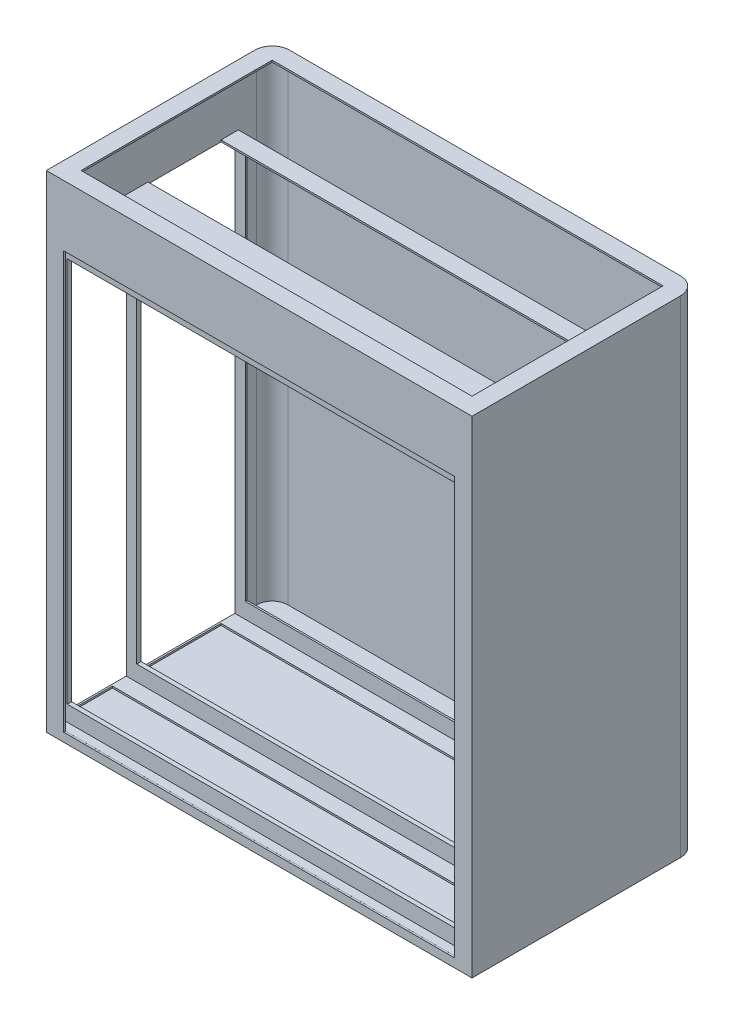
from build123d import *

# Parameters (mm, degrees)
BOSS_EXTRUDE1_DEPTH = 711.2
BOSS_EXTRUDE2_REACH = 963.601
SKETCH2_W           = 12.7
SKETCH2_H           = 2.54
SKETCH3_W           = 152.4
SKETCH3_H           = 609.6
SKETCH3_W_2         = 95.25
SKETCH3_W_3         = 12.7
CUT_EXTRUDE1_DEPTH  = 2.54
SKETCH4_W           = 12.7
SKETCH4_H           = 6.35
SKETCH4_H_2         = 2.54
BOSS_EXTRUDE3_DEPTH = 589.28
SKETCH5_W           = 571.5
SKETCH5_H           = 12.668198963
BOSS_EXTRUDE4_DEPTH = 2.54
BOSS_EXTRUDE5_START = -2.54
BOSS_EXTRUDE5_DEPTH = 2.54
SKETCH7_W           = 571.5
SKETCH7_H           = 19.05
BOSS_EXTRUDE6_DEPTH = 2.54
SKETCH9_W           = 571.5
SKETCH9_H           = 2.54
BOSS_EXTRUDE7_DEPTH = 69.85
SKETCH10_W          = 571.5
SKETCH10_H          = 22.86
BOSS_EXTRUDE8_DEPTH = 2.54
BOSS_EXTRUDE9_START = 10.16
BOSS_EXTRUDE9_DEPTH = 10.16


with BuildPart() as part:
    # Sketch1 → Boss-Extrude1 (new body)
    with BuildSketch(Plane(origin=(0, 0, 0), x_dir=(1, 0, 0), z_dir=(0, 1, 0))):
        with BuildLine():
            Line((-285.75, 175.26), (285.75, 175.26))
            ThreePointArc((285.75, 175.26), (301.914461018, 168.564461018), (308.61, 152.4))
            Line((308.61, 152.4), (308.61, -149.86))
            Line((308.61, -149.86), (285.75, -149.86))
            Line((285.75, -149.86), (285.75, -152.4))
            Line((285.75, -152.4), (311.15, -152.4))
            Line((311.15, -152.4), (311.15, 152.4))
            ThreePointArc((311.15, 152.4), (303.710512242, 170.360512242), (285.75, 177.8))
            Line((285.75, 177.8), (-285.75, 177.8))
            ThreePointArc((-285.75, 177.8), (-303.710512242, 170.360512242), (-311.15, 152.4))
            Line((-311.15, 152.4), (-311.15, -152.4))
            Line((-311.15, -152.4), (-285.75, -152.4))
            Line((-285.75, -152.4), (-285.75, -149.86))
            Line((-285.75, -149.86), (-308.61, -149.86))
            Line((-308.61, -149.86), (-308.61, 152.4))
            ThreePointArc((-308.61, 152.4), (-301.914461018, 168.564461018), (-285.75, 175.26))
        make_face()
    extrude(amount=BOSS_EXTRUDE1_DEPTH)

    # Boss-Extrude2: up to this face of the body (flat: up to its plane)
    boss_extrude2_end = Plane(part.part.faces().sort_by_distance((308.61, 355.6, -1.27))[0])
    # Sketch2 → Boss-Extrude2 (add, up to the picked face)
    with BuildSketch(Plane.ZY.offset(311.15), mode=Mode.PRIVATE) as boss_extrude2_sk1:
        Polygon((-100.33, 622.3), (-123.19, 622.3), (-123.19, 599.44), (-125.73, 599.44), (-125.73, 624.84), (-100.33, 624.84), align=None)
    boss_extrude2_tool1 = split(extrude(boss_extrude2_sk1.sketch, amount=-BOSS_EXTRUDE2_REACH, mode=Mode.PRIVATE), bisect_by=boss_extrude2_end, keep=Keep.BOTH, mode=Mode.PRIVATE)
    # Sketch2 → Boss-Extrude2 (add, up to the picked face)
    with BuildSketch(Plane.ZY.offset(311.15), mode=Mode.PRIVATE) as boss_extrude2_sk2:
        Polygon((58.42, 622.3), (35.56, 622.3), (35.56, 599.44), (29.21, 599.44), (29.21, 622.3), (6.35, 622.3), (6.35, 624.84), (58.42, 624.84), align=None)
    boss_extrude2_tool2 = split(extrude(boss_extrude2_sk2.sketch, amount=-BOSS_EXTRUDE2_REACH, mode=Mode.PRIVATE), bisect_by=boss_extrude2_end, keep=Keep.BOTH, mode=Mode.PRIVATE)
    # Sketch2 → Boss-Extrude2 (add, up to the picked face)
    with BuildSketch(Plane.ZY.offset(311.15), mode=Mode.PRIVATE) as boss_extrude2_sk3:
        Polygon((134.099064666, 599.44), (130.81, 599.44), (130.81, 622.3), (111.76, 622.3), (111.76, 624.84), (137.16, 624.84), (149.86, 624.84), (149.86, 622.3), (137.16, 622.3), (137.16, 599.44), align=None)
    boss_extrude2_tool3 = split(extrude(boss_extrude2_sk3.sketch, amount=-BOSS_EXTRUDE2_REACH, mode=Mode.PRIVATE), bisect_by=boss_extrude2_end, keep=Keep.BOTH, mode=Mode.PRIVATE)
    # Sketch2 → Boss-Extrude2 (add, up to the picked face)
    with BuildSketch(Plane.ZY.offset(311.15), mode=Mode.PRIVATE) as boss_extrude2_sk4:
        Polygon((-123.19, 35.56), (-123.19, 12.7), (-100.33, 12.7), (-100.33, 10.16), (-125.73, 10.16), (-125.73, 35.56), align=None)
    boss_extrude2_tool4 = split(extrude(boss_extrude2_sk4.sketch, amount=-BOSS_EXTRUDE2_REACH, mode=Mode.PRIVATE), bisect_by=boss_extrude2_end, keep=Keep.BOTH, mode=Mode.PRIVATE)
    # Sketch2 → Boss-Extrude2 (add, up to the picked face)
    with BuildSketch(Plane.ZY.offset(311.15), mode=Mode.PRIVATE) as boss_extrude2_sk5:
        Polygon((58.42, 12.7), (58.42, 10.16), (6.35, 10.16), (6.35, 12.7), (29.21, 12.7), (29.21, 35.56), (35.56, 35.56), (35.56, 12.7), align=None)
    boss_extrude2_tool5 = split(extrude(boss_extrude2_sk5.sketch, amount=-BOSS_EXTRUDE2_REACH, mode=Mode.PRIVATE), bisect_by=boss_extrude2_end, keep=Keep.BOTH, mode=Mode.PRIVATE)
    # Sketch2 → Boss-Extrude2 (add, up to the picked face)
    with BuildSketch(Plane.ZY.offset(311.15), mode=Mode.PRIVATE) as boss_extrude2_sk6:
        Polygon((137.16, 35.56), (137.16, 12.7), (137.16, 10.16), (111.76, 10.16), (111.76, 12.7), (130.81, 12.7), (130.81, 35.56), (134.099064666, 35.56), align=None)
    boss_extrude2_tool6 = split(extrude(boss_extrude2_sk6.sketch, amount=-BOSS_EXTRUDE2_REACH, mode=Mode.PRIVATE), bisect_by=boss_extrude2_end, keep=Keep.BOTH, mode=Mode.PRIVATE)
    # Sketch2 → Boss-Extrude2 (add, up to the picked face)
    with BuildSketch(Plane.ZY.offset(311.15), mode=Mode.PRIVATE) as boss_extrude2_sk7:
        with Locations((143.51, 11.43)):
            Rectangle(SKETCH2_W, SKETCH2_H)
    boss_extrude2_tool7 = split(extrude(boss_extrude2_sk7.sketch, amount=-BOSS_EXTRUDE2_REACH, mode=Mode.PRIVATE), bisect_by=boss_extrude2_end, keep=Keep.BOTH, mode=Mode.PRIVATE)
    add(boss_extrude2_tool1.solids().sort_by(Axis((-311.15, 622.65921, -111.76), (1, 0, 0)))[0])
    add(boss_extrude2_tool2.solids().sort_by(Axis((-311.15, 616.924651, 32.385), (1, 0, 0)))[0])
    add(boss_extrude2_tool3.solids().sort_by(Axis((-311.15, 615.95, 132.715), (1, 0, 0)))[0])
    add(boss_extrude2_tool4.solids().sort_by(Axis((-311.15, 24.13, -123.54921), (1, 0, 0)))[0])
    add(boss_extrude2_tool5.solids().sort_by(Axis((-311.15, 18.075349, 32.385), (1, 0, 0)))[0])
    add(boss_extrude2_tool6.solids().sort_by(Axis((-311.15, 20.222308, 131.054231), (1, 0, 0)))[0])
    add(boss_extrude2_tool7.solids().sort_by(Axis((-311.15, 11.43, 143.51), (1, 0, 0)))[0])

    # Sketch3 → Cut-Extrude1 (cut)
    with BuildSketch(Plane.ZY.offset(311.15)):
        with Locations((-46.99, 317.5)):
            Rectangle(SKETCH3_W, SKETCH3_H)
        with Locations((83.185, 317.5)):
            Rectangle(SKETCH3_W_2, SKETCH3_H)
        with Locations((143.51, 317.5)):
            Rectangle(SKETCH3_W_3, SKETCH3_H)
    extrude(amount=-CUT_EXTRUDE1_DEPTH, mode=Mode.SUBTRACT)

    # Sketch4 → Boss-Extrude3 (add)
    with BuildSketch(Plane(origin=(0, 624.84, 0), x_dir=(1, 0, 0), z_dir=(0, 1, 0))):
        with Locations((-302.26, -32.385)):
            Rectangle(SKETCH4_W, SKETCH4_H)
        with Locations((-302.26, -133.985)):
            Rectangle(SKETCH4_W, SKETCH4_H)
        with Locations((-302.26, 124.46)):
            Rectangle(SKETCH4_W, SKETCH4_H_2)
        with Locations((302.26, -133.985)):
            Rectangle(SKETCH4_W, SKETCH4_H)
        with Locations((302.26, -32.385)):
            Rectangle(SKETCH4_W, SKETCH4_H)
        with Locations((302.26, 124.46)):
            Rectangle(SKETCH4_W, SKETCH4_H_2)
    extrude(amount=-BOSS_EXTRUDE3_DEPTH)

    # Sketch5 → Boss-Extrude4 (add)
    with BuildSketch(Plane.XY.offset(152.4)):
        with Locations((0, 6.334099482)):
            Rectangle(SKETCH5_W, SKETCH5_H)
    extrude(amount=-BOSS_EXTRUDE4_DEPTH)

    # Sketch6 → Boss-Extrude5 (add)
    with BuildSketch(Plane(origin=(0, 711.2, 0), x_dir=(1, 0, 0), z_dir=(0, 1, 0)).offset(BOSS_EXTRUDE5_START)):
        with BuildLine():
            Line((-285.75, -149.86), (-285.75, -124.46))
            Line((-285.75, -124.46), (-285.75, 152.4))
            Line((-285.75, 152.4), (285.75, 152.4))
            Line((285.75, 152.4), (285.75, -127))
            Line((285.75, -127), (285.75, -149.86))
            Line((285.75, -149.86), (308.61, -149.86))
            Line((308.61, -149.86), (308.61, 152.4))
            ThreePointArc((308.61, 152.4), (301.914461018, 168.564461018), (285.75, 175.26))
            Line((285.75, 175.26), (-285.75, 175.26))
            ThreePointArc((-285.75, 175.26), (-301.914461018, 168.564461018), (-308.61, 152.4))
            Line((-308.61, 152.4), (-308.61, -149.86))
            Line((-308.61, -149.86), (-285.75, -149.86))
        make_face()
    extrude(amount=BOSS_EXTRUDE5_DEPTH)

    # Sketch7 → Boss-Extrude6 (add)
    with BuildSketch(Plane.XY.offset(149.86)):
        with Locations((0, 631.825)):
            Rectangle(SKETCH7_W, SKETCH7_H)
    extrude(amount=BOSS_EXTRUDE6_DEPTH)

    # Sketch9 → Boss-Extrude7 (add)
    with BuildSketch(Plane(origin=(0, 641.35, 0), x_dir=(1, 0, 0), z_dir=(0, 1, 0))):
        with Locations((0, -151.13)):
            Rectangle(SKETCH9_W, SKETCH9_H)
    extrude(amount=BOSS_EXTRUDE7_DEPTH)

    # Sketch10 → Boss-Extrude8 (add)
    with BuildSketch(Plane(origin=(0, 711.2, 0), x_dir=(1, 0, 0), z_dir=(0, 1, 0))):
        with Locations((0, -138.43)):
            Rectangle(SKETCH10_W, SKETCH10_H)
    extrude(amount=-BOSS_EXTRUDE8_DEPTH)

    # Sketch11 → Boss-Extrude9 (add)
    with BuildSketch(Plane.XZ.offset(-10.16).offset(BOSS_EXTRUDE9_START)):
        with BuildLine():
            Line((-308.61, 149.86), (-308.61, -152.4))
            ThreePointArc((-308.61, -152.4), (-301.914461018, -168.564461018), (-285.75, -175.26))
            Line((-285.75, -175.26), (285.75, -175.26))
            ThreePointArc((285.75, -175.26), (301.914461018, -168.564461018), (308.61, -152.4))
            Line((308.61, -152.4), (308.61, 149.86))
            Line((308.61, 149.86), (-308.61, 149.86))
        make_face()
    extrude(amount=-BOSS_EXTRUDE9_DEPTH)


solid = part.part
